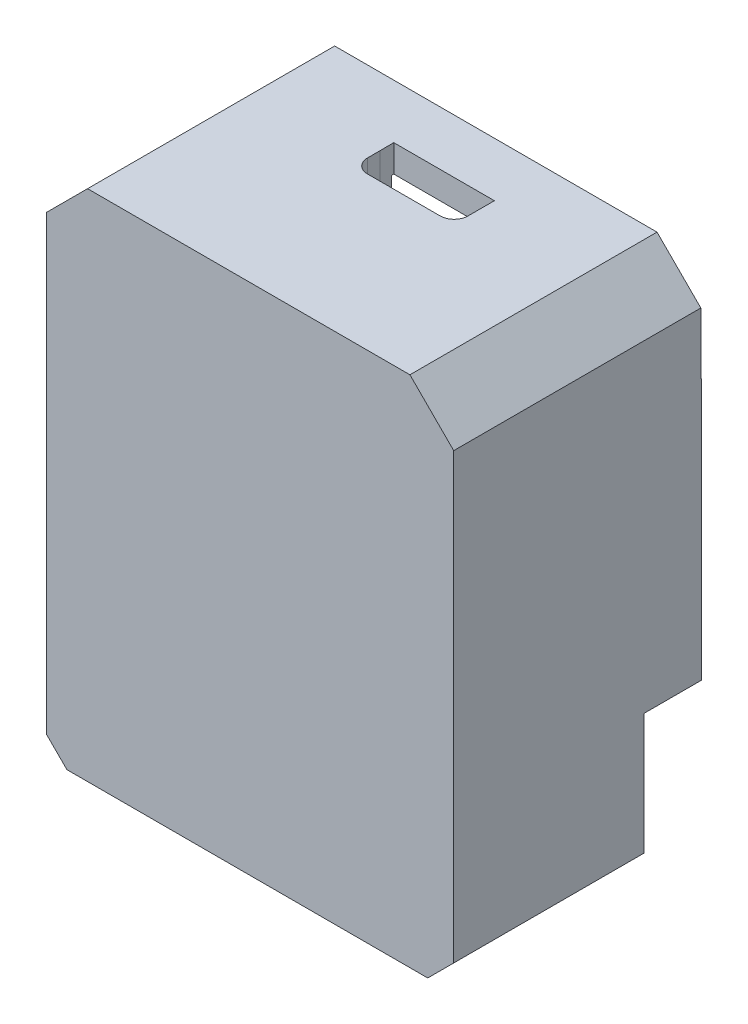
from build123d import *

# Parameters (mm, degrees)
EXTRUDE_1_DEPTH      = 15
EXTRUDE_2_DEPTH      = 2
SKETCH_3_W           = 2
SKETCH_3_H           = 30
EXTRUDE_3_DEPTH      = 2
SKETCH_4_W           = 2
SKETCH_4_H           = 30
EXTRUDE_4_DEPTH      = 2
EXTRUDE_START        = 7
EXTRUDE_5_DEPTH      = 5.5
EXTRUDE_6_DEPTH      = 7.3
EXTRUDE_6_DEPTH_BACK = 16
EXTRUDE_7_DEPTH      = 23.3
EXTRUDE_9_DEPTH      = 5.05
CUT_EXTRUDE_3_DEPTH  = 8.15


with BuildPart() as part:
    # 草图1 → 凸台-拉伸1 (new body)
    with BuildSketch(Plane.XY):
        Polygon((15.781834721, -29.117348235), (18.100330201, -26.798852755), (18.100330201, 12.794403278), (14.191406072, 16.703327407), (-14.572406834, 16.703327407), (-18.227330455, 13.048403786), (-18.227330455, -27.306853771), (-16.416835991, -29.117348235), align=None)
        with BuildLine():
            ThreePointArc((-15.190500381, -26.798852755), (-15.897607162, -26.505959536), (-16.190500381, -25.798852755))
            Line((-16.190500381, -25.798852755), (-16.190500381, 11.201147245))
            ThreePointArc((-16.190500381, 11.201147245), (-15.897607162, 11.908254026), (-15.190500381, 12.201147245))
            Line((-15.190500381, 12.201147245), (14.809499619, 12.201147245))
            ThreePointArc((14.809499619, 12.201147245), (15.5166064, 11.908254026), (15.809499619, 11.201147245))
            Line((15.809499619, 11.201147245), (15.809499619, -25.798852755))
            ThreePointArc((15.809499619, -25.798852755), (15.5166064, -26.505959536), (14.809499619, -26.798852755))
            Line((14.809499619, -26.798852755), (-15.190500381, -26.798852755))
        make_face(mode=Mode.SUBTRACT)
    extrude(amount=EXTRUDE_1_DEPTH)

    # 草图2 → 凸台-拉伸2 (add)
    with BuildSketch(Plane.XY.offset(15)):
        Polygon((-14.572406834, 16.703327407), (-18.227330455, 13.048403786), (-18.227330455, -27.306853771), (-16.416835991, -29.117348235), (-0.317500635, -29.117348235), (15.781834721, -29.117348235), (18.100330201, -26.798852755), (18.100330201, 12.794403278), (14.191406072, 16.703327407), align=None)
    extrude(amount=EXTRUDE_2_DEPTH)

    # 草图3 → 凸台-拉伸3 (add)
    with BuildSketch(Plane(origin=(-16.190500381, 0, 0), x_dir=(0, 0, -1), z_dir=(1, 0, 0))):
        with Locations((-1, -5.798852755)):
            Rectangle(SKETCH_3_W, SKETCH_3_H)
    extrude(amount=EXTRUDE_3_DEPTH)

    # 草图4 → 凸台-拉伸4 (add)
    with BuildSketch(Plane.ZY.offset(-15.809499619)):
        with Locations((1, -5.798852755)):
            Rectangle(SKETCH_4_W, SKETCH_4_H)
    extrude(amount=EXTRUDE_4_DEPTH)

    # 草图5 → 凸台-拉伸5 (add)
    with BuildSketch(Plane(origin=(0, 0, 0), x_dir=(0, 0, -1), z_dir=(1, 0, 0)).offset(EXTRUDE_START)):
        Polygon((3.1000508, 15.353327407), (0, 15.353327407), (0, 14.003327407), (2.1000508, 14.003327407), (2.1000508, 13.703327407), (2.1000508, 12.703327407), (3.1000508, 12.703327407), align=None)
    extrude_5 = extrude(amount=EXTRUDE_5_DEPTH)

    # 镜向1: 凸台-拉伸5 across plane
    add(extrude_5.mirror(Plane(origin=(0, 0, 0), x_dir=(0, 0, 1), z_dir=(1, 0, 0))))

    # 草图7 → 凸台-拉伸6 (add, two sides: drawn at the far end of the back side and taken through both)
    with BuildSketch(Plane(origin=(0, 0, 0), x_dir=(1, 0, 0), z_dir=(0, 1, 0)).offset(-EXTRUDE_6_DEPTH_BACK)):
        Polygon((-18.227330455, 3.1), (-18.227330455, 0), (-15.477330455, 0), (-15.477330455, 2.1000508), (-15.227330455, 2.1000508), (-11.227330455, 2.1000508), (-11.227330455, 3.1), (-16.227330455, 3.1), (-16.227330455, 4.1), (-11.227330455, 4.1), (-11.227330455, 5.1), (-18.227330455, 5.1), (-18.227330455, 4.1), align=None)
    extrude(amount=EXTRUDE_6_DEPTH + EXTRUDE_6_DEPTH_BACK)

    # 草图10 → 凸台-拉伸7 (add)
    with BuildSketch(Plane.XZ.offset(16)):
        Polygon((16.227721063, -3.100000069), (11.227330455, -3.100000069), (11.227330455, -2.048141563), (15.600330201, -2.048141563), (15.600330201, -1.6000508), (15.600330201, 0), (16.226569186, 0.001858295), (18.100330201, 0), (18.100330201, -5.1), (11.227330455, -5.1), (11.227330455, -4.1), (16.228092414, -4.1), align=None)
    extrude(amount=-EXTRUDE_7_DEPTH)

    # 草图11 → 凸台-拉伸9 (add)
    with BuildSketch(Plane(origin=(0, 0, 0), x_dir=(-1, 0, 0), z_dir=(0, 0, -1))):
        Polygon((-15.220330201, 7.12413323), (-18.100330201, 7.12413323), (-18.100330201, 12.794403278), (-14.191406072, 16.703327407), (14.572406834, 16.703327407), (18.227330455, 13.048403786), (18.227330455, 7.12413323), (15.347330455, 7.12413323), (15.347330455, 11.855468727), (13.414618961, 13.78818022), (12.930706389, 14.272092792), (-12.549705627, 14.272092792), (-15.220330201, 11.601468219), align=None)
    extrude(amount=EXTRUDE_9_DEPTH)

    # 草图14 → 切除-拉伸3 (cut)
    with BuildSketch(Plane(origin=(0, 16.703327407, 0), x_dir=(1, 0, 0), z_dir=(0, 1, 0))):
        with BuildLine():
            ThreePointArc((-4.458496317, -2.139582087), (-4.096481847, -3.01356233), (-3.222501604, -3.3755768))
            Line((-3.222501604, -3.3755768), (3.273301705, -3.3755768))
            ThreePointArc((3.273301705, -3.3755768), (4.147281949, -3.01356233), (4.509296419, -2.139582087))
            Line((4.509296419, -2.139582087), (4.509296419, 0.219606282))
            Line((4.509296419, 0.219606282), (-4.470508001, 0.219606282))
            Line((-4.470508001, 0.219606282), (-4.458496317, -1.016388431))
            Line((-4.458496317, -1.016388431), (-4.458496317, -2.139582087))
        make_face()
    extrude(amount=-CUT_EXTRUDE_3_DEPTH, mode=Mode.SUBTRACT)


solid = part.part
